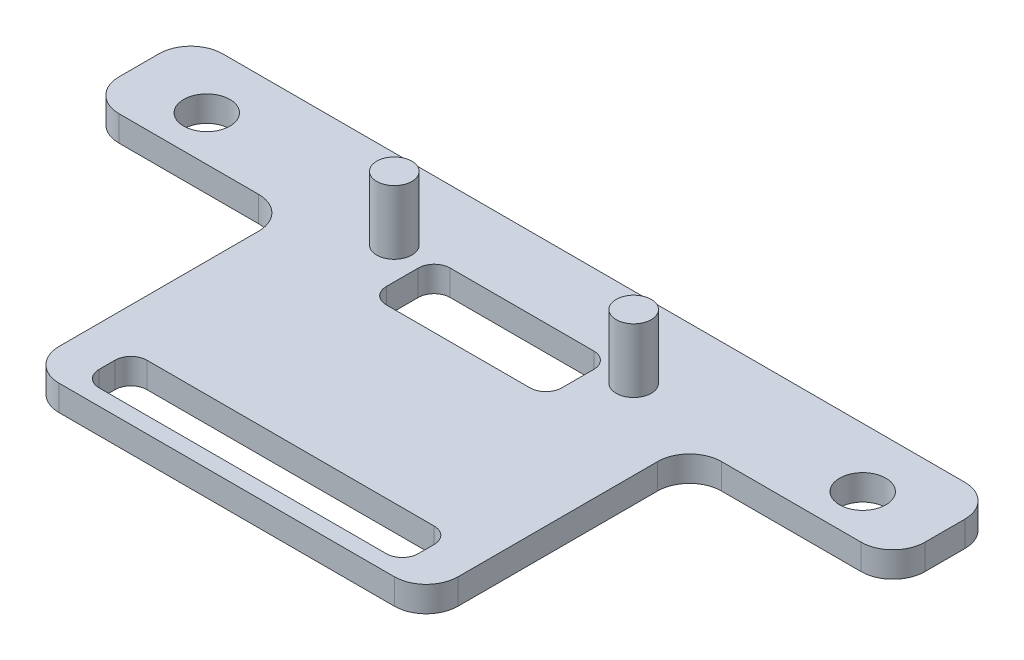
from build123d import *

# Parameters (mm, degrees)
SKIZZE1_R                       = 1.45
AUFSATZ_LINEAR_AUSTRAGEN1_DEPTH = 1.6
VERRUNDUNG1_R                   = 2
SKIZZE2_R                       = 1.1
AUFSATZ_LINEAR_AUSTRAGEN2_DEPTH = 4
SKIZZE3_W                       = 11
SKIZZE3_H                       = 4
SCHNITT_LINEAR_AUSTRAGEN1_DEPTH = 3
VERRUNDUNG2_R                   = 1
SKIZZE4_W                       = 20
SKIZZE4_H                       = 3
SCHNITT_LINEAR_AUSTRAGEN2_DEPTH = 3
VERRUNDUNG3_R                   = 1


with BuildPart() as part:
    # Skizze1 → Aufsatz-Linear austragen1 (new body)
    with BuildSketch(Plane(origin=(0, 0, 0), x_dir=(1, 0, 0), z_dir=(0, 1, 0))):
        Polygon((0, 0), (50.5, 0), (50.5, -6.5), (37.75, -6.5), (37.75, -23), (12.75, -23), (12.75, -6.5), (0, -6.5), align=None)
        with Locations(Location((4.7, -3.7, 0), (0, 0, 270))):
            Circle(SKIZZE1_R, mode=Mode.SUBTRACT)
        with Locations(Location((45.8, -3.7, 0), (0, 0, 90))):
            Circle(SKIZZE1_R, mode=Mode.SUBTRACT)
    extrude(amount=AUFSATZ_LINEAR_AUSTRAGEN1_DEPTH)

    # Verrundung1
    verrundung1_edges = [part.edges().sort_by_distance(p)[0] for p in [
        (0, 0.8, 0),
        (50.5, 0.8, 0),
        (50.5, 0.8, 6.5),
        (37.75, 0.8, 6.5),
        (37.75, 0.8, 23),
        (12.75, 0.8, 23),
        (12.75, 0.8, 6.5),
        (0, 0.8, 6.5),
    ]]
    fillet(verrundung1_edges, radius=VERRUNDUNG1_R)

    # Skizze2 → Aufsatz-Linear austragen2 (add)
    with BuildSketch(Plane(origin=(0, 1.6, 0), x_dir=(1, 0, 0), z_dir=(0, 1, 0))):
        with Locations(Location((17.75, -5, 0), (0, 0, 270))):
            Circle(SKIZZE2_R)
        with Locations(Location((32.75, -5, 0), (0, 0, 90))):
            Circle(SKIZZE2_R)
    extrude(amount=AUFSATZ_LINEAR_AUSTRAGEN2_DEPTH)

    # Skizze3 → Schnitt-Linear austragen1 (cut)
    with BuildSketch(Plane(origin=(0, 1.6, 0), x_dir=(1, 0, 0), z_dir=(0, 1, 0))):
        with Locations((25.25, -6.5)):
            Rectangle(SKIZZE3_W, SKIZZE3_H)
    extrude(amount=-SCHNITT_LINEAR_AUSTRAGEN1_DEPTH, mode=Mode.SUBTRACT)

    # Verrundung2
    verrundung2_edges = [part.edges().sort_by_distance(p)[0] for p in [
        (19.75, 0.8, 8.5),
        (19.75, 0.8, 4.5),
        (30.75, 0.8, 4.5),
        (30.75, 0.8, 8.5),
    ]]
    fillet(verrundung2_edges, radius=VERRUNDUNG2_R)

    # Skizze4 → Schnitt-Linear austragen2 (cut)
    with BuildSketch(Plane(origin=(0, 1.6, 0), x_dir=(1, 0, 0), z_dir=(0, 1, 0))):
        with Locations((25.25, -20.5)):
            Rectangle(SKIZZE4_W, SKIZZE4_H)
    extrude(amount=-SCHNITT_LINEAR_AUSTRAGEN2_DEPTH, mode=Mode.SUBTRACT)

    # Verrundung3
    verrundung3_edges = [part.edges().sort_by_distance(p)[0] for p in [
        (15.25, 0.8, 22),
        (15.25, 0.8, 19),
        (35.25, 0.8, 19),
        (35.25, 0.8, 22),
    ]]
    fillet(verrundung3_edges, radius=VERRUNDUNG3_R)


solid = part.part
